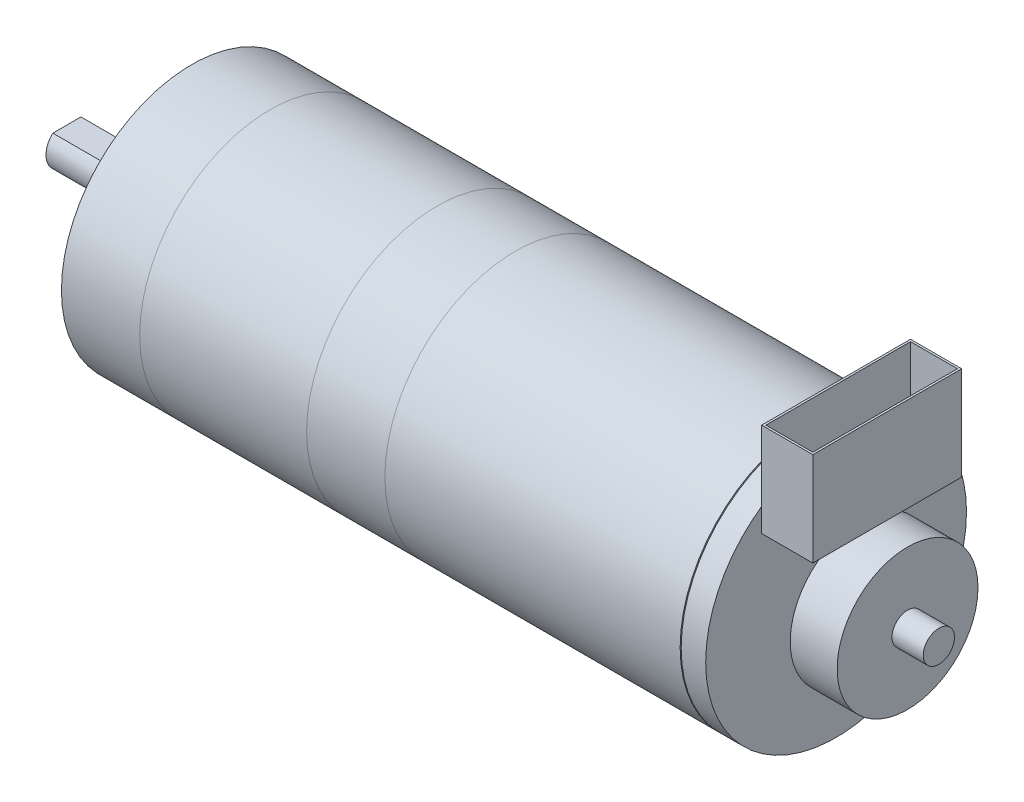
from build123d import *

# Parameters (mm, degrees)
SKETCH_1_R          = 12.5
EXTRUDE_1_DEPTH     = 7.5
SKETCH_3_R          = 12.5
EXTRUDE_3_DEPTH     = 16
SKETCH_4_R          = 12.5
EXTRUDE_4_DEPTH     = 7.5
SKETCH_5_R          = 12.5
EXTRUDE_5_DEPTH     = 28.3
SKETCH_6_R          = 1.5
EXTRUDE_10_DEPTH    = 0.1
SKETCH_10_R         = 12.5
EXTRUDE_11_DEPTH    = 2.35
SKETCH_12_R         = 1.5
EXTRUDE_12_DEPTH    = 2.35
SKETCH_13_R         = 6.75
EXTRUDE_13_DEPTH    = 4.5
SKETCH_14_R         = 1.5
EXTRUDE_14_DEPTH    = 3
EXTRUDE_START       = 8
SKETCH_15_W         = 4.9
SKETCH_15_H         = 14.26
SKETCH_15_W_2       = 4.5
SKETCH_15_H_2       = 13.86
EXTRUDE_1_2_DEPTH   = 9
SKETCH_16_R         = 3.5
EXTRUDE_15_DEPTH    = 2.38
SKETCH_17_R         = 2
EXTRUDE_16_DEPTH    = 9.6
SKETCH_18_W         = 2.690427476
SKETCH_18_H         = 0.755115775
CUT_EXTRUDE_1_DEPTH = 8
SKETCH_19_R         = 1.75
CUT_EXTRUDE_2_DEPTH = 3.5


with BuildPart() as part:
    # 草图1 → Extrude 1 (new body)
    with BuildSketch(Plane(origin=(0, 0, 0), x_dir=(0, 0, -1), z_dir=(1, 0, 0))):
        Circle(SKETCH_1_R)
    extrude(amount=EXTRUDE_1_DEPTH)

    # 草图16 → 凸台-拉伸15 (add)
    with BuildSketch(Plane.ZY):
        Circle(SKETCH_16_R)
    extrude(amount=EXTRUDE_15_DEPTH)

    # 草图17 → 凸台-拉伸16 (add)
    with BuildSketch(Plane.ZY.offset(2.38)):
        Circle(SKETCH_17_R)
    extrude(amount=EXTRUDE_16_DEPTH)

    # 草图18 → 切除-拉伸1 (cut)
    with BuildSketch(Plane.ZY.offset(11.98)):
        with Locations((0, 1.857557888)):
            Rectangle(SKETCH_18_W, SKETCH_18_H)
    extrude(amount=-CUT_EXTRUDE_1_DEPTH, mode=Mode.SUBTRACT)

    # 草图19 → 切除-拉伸2 (cut)
    with BuildSketch(Plane.ZY):
        with Locations((8.5, 0)):
            Circle(SKETCH_19_R)
    cut_extrude_2 = extrude(amount=-CUT_EXTRUDE_2_DEPTH, mode=Mode.SUBTRACT)

    # 镜向1: 切除-拉伸2 across plane
    add(cut_extrude_2.mirror(Plane.XY), mode=Mode.SUBTRACT)


with BuildPart() as body_2:
    # 草图3 → 凸台-拉伸3 (new body)
    with BuildSketch(Plane(origin=(7.5, 0, 0), x_dir=(0, 0, -1), z_dir=(1, 0, 0))):
        Circle(SKETCH_3_R)
    extrude(amount=EXTRUDE_3_DEPTH)


with BuildPart() as body_3:
    # 草图4 → 凸台-拉伸4 (new body)
    with BuildSketch(Plane(origin=(23.5, 0, 0), x_dir=(0, 0, -1), z_dir=(1, 0, 0))):
        Circle(SKETCH_4_R)
    extrude(amount=EXTRUDE_4_DEPTH)


with BuildPart() as body_4:
    # 草图5 → 凸台-拉伸5 (new body)
    with BuildSketch(Plane(origin=(31, 0, 0), x_dir=(0, 0, -1), z_dir=(1, 0, 0))):
        Circle(SKETCH_5_R)
    extrude(amount=EXTRUDE_5_DEPTH)

    # 草图6 → 凸台-拉伸10 (add)
    with BuildSketch(Plane(origin=(59.3, 0, 0), x_dir=(0, 0, -1), z_dir=(1, 0, 0))):
        Circle(SKETCH_6_R)
    extrude(amount=EXTRUDE_10_DEPTH)

    # 草图10 → 凸台-拉伸11 (add)
    with BuildSketch(Plane(origin=(59.4, 0, 0), x_dir=(0, 0, -1), z_dir=(1, 0, 0))):
        Circle(SKETCH_10_R)
    extrude(amount=EXTRUDE_11_DEPTH)

    # 草图12 → 凸台-拉伸12 (add)
    with BuildSketch(Plane(origin=(61.75, 0, 0), x_dir=(0, 0, -1), z_dir=(1, 0, 0))):
        Circle(SKETCH_12_R)
    extrude(amount=EXTRUDE_12_DEPTH)

    # 草图13 → 凸台-拉伸13 (add)
    with BuildSketch(Plane(origin=(64.1, 0, 0), x_dir=(0, 0, -1), z_dir=(1, 0, 0))):
        Circle(SKETCH_13_R)
    extrude(amount=EXTRUDE_13_DEPTH)

    # 草图14 → 凸台-拉伸14 (add)
    with BuildSketch(Plane(origin=(68.6, 0, 0), x_dir=(0, 0, -1), z_dir=(1, 0, 0))):
        Circle(SKETCH_14_R)
    extrude(amount=EXTRUDE_14_DEPTH)


with BuildPart() as body_5:
    # 草图15 → Extrude 1 2 (new body)
    with BuildSketch(Plane(origin=(0, 0, 0), x_dir=(1, 0, 0), z_dir=(0, 1, 0)).offset(EXTRUDE_START)):
        with Locations((64.2, 0)):
            Rectangle(SKETCH_15_W, SKETCH_15_H)
        with Locations((64.2, 0)):
            Rectangle(SKETCH_15_W_2, SKETCH_15_H_2, mode=Mode.SUBTRACT)
    extrude(amount=EXTRUDE_1_2_DEPTH)


solid = Compound([part.part, body_2.part, body_3.part, body_4.part, body_5.part])
